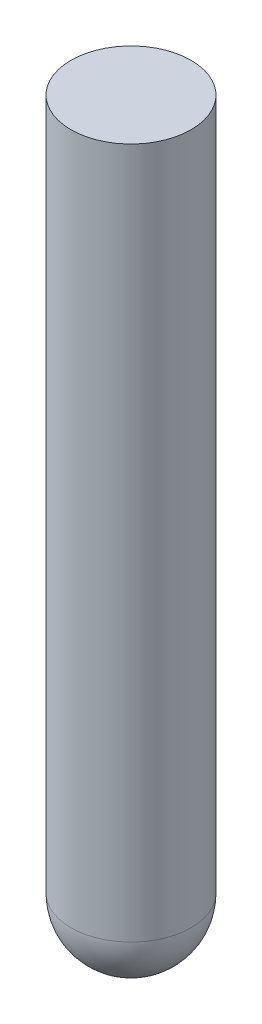
from build123d import *

# Parameters (mm, degrees)
SKETCH1_R           = 4
BOSS_EXTRUDE1_DEPTH = 50
FILLET1_R           = 4


with BuildPart() as part:
    # Sketch1 → Boss-Extrude1 (new body)
    with BuildSketch(Plane(origin=(0, 0, 0), x_dir=(1, 0, 0), z_dir=(0, 1, 0))):
        with Locations(Location((0, 0, 0), (0, 0, 270))):
            Circle(SKETCH1_R)
    extrude(amount=BOSS_EXTRUDE1_DEPTH)

    # Fillet1
    fillet1_edges = [part.edges().sort_by_distance(p)[0] for p in [
        (0, 0, -4),
    ]]
    fillet(fillet1_edges, radius=FILLET1_R)


solid = part.part
